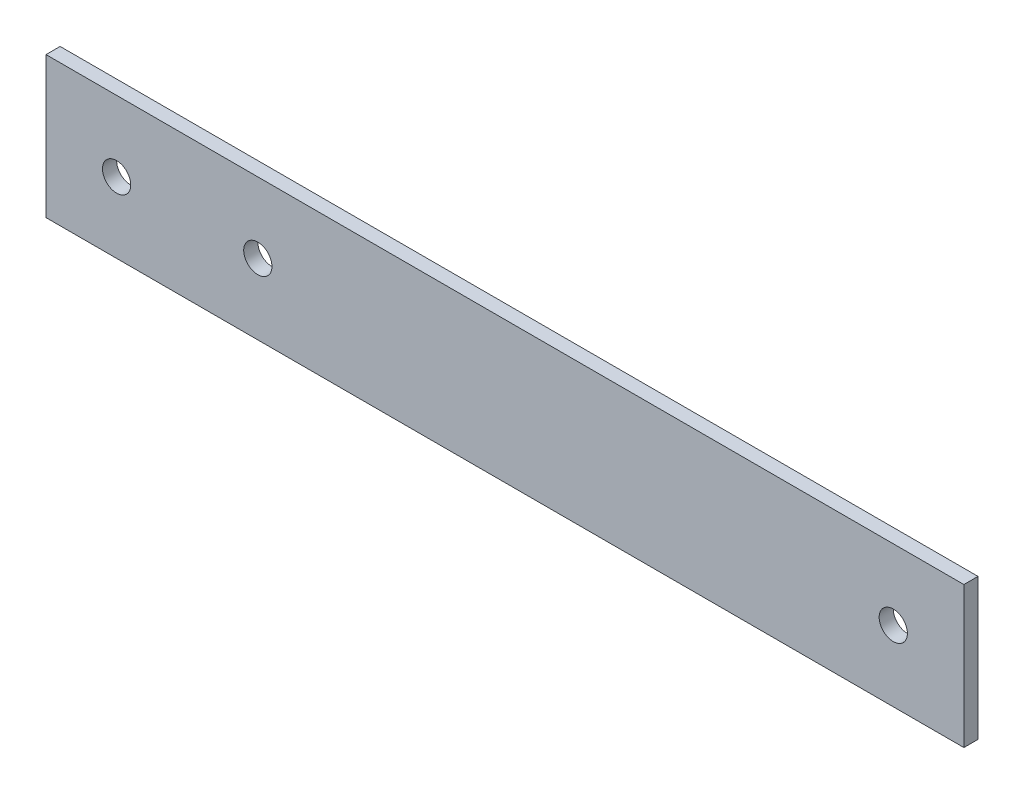
from build123d import *

# Parameters (mm, degrees)
SKETCH1_W           = 130
SKETCH1_H           = 20
BOSS_EXTRUDE1_DEPTH = 2
SKETCH2_R           = 2
CUT_EXTRUDE1_DEPTH  = 2
SKETCH3_R           = 2
CUT_EXTRUDE2_DEPTH  = 2


with BuildPart() as part:
    # Sketch1 → Boss-Extrude1 (new body)
    with BuildSketch(Plane.XY):
        Rectangle(SKETCH1_W, SKETCH1_H)
    extrude(amount=BOSS_EXTRUDE1_DEPTH)

    # Sketch2 → Cut-Extrude1 (cut)
    with BuildSketch(Plane.XY.offset(2)):
        with Locations((-55, 0)):
            Circle(SKETCH2_R)
        with Locations((55, 0)):
            Circle(SKETCH2_R)
    extrude(amount=-CUT_EXTRUDE1_DEPTH, mode=Mode.SUBTRACT)

    # Sketch3 → Cut-Extrude2 (cut)
    with BuildSketch(Plane.XY.offset(2)):
        with Locations((-35, 0)):
            Circle(SKETCH3_R)
    extrude(amount=-CUT_EXTRUDE2_DEPTH, mode=Mode.SUBTRACT)


solid = part.part
